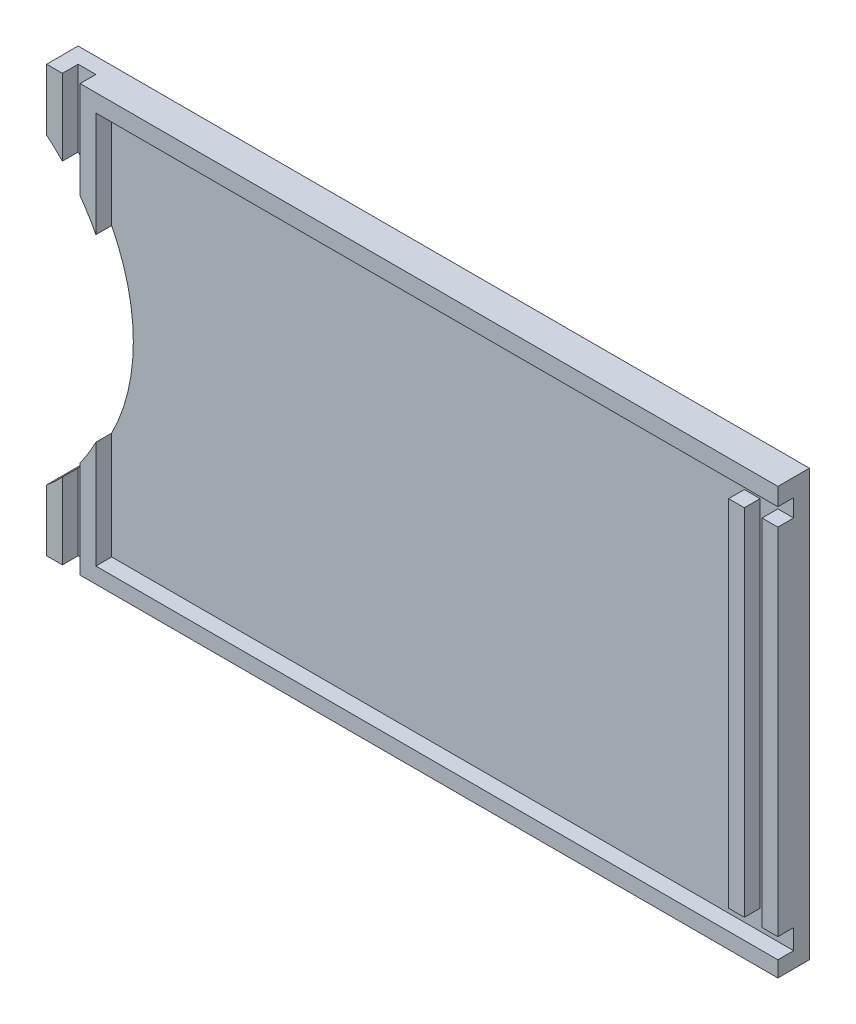
from build123d import *

# Parameters (mm, degrees)
BOSS_EXTRUDE1_DEPTH = 54
SKETCH7_W           = 12.542465984
SKETCH7_H           = 8.941456765
CUT_EXTRUDE4_DEPTH  = 4
SKETCH8_W           = 12.536281236
SKETCH8_H           = 9.084679825
CUT_EXTRUDE5_DEPTH  = 4
SKETCH10_R          = 50
CUT_EXTRUDE6_DEPTH  = 10
SKETCH12_W          = 173
SKETCH12_H          = 4
SKETCH12_H_2        = 4.470728383
BOSS_EXTRUDE2_DEPTH = 4


with BuildPart() as part:
    # Sketch1 → Boss-Extrude1 (new, symmetric)
    with BuildSketch(Plane(origin=(0, 0, 0), x_dir=(1, 0, 0), z_dir=(0, 1, 0))):
        Polygon((-63.408892702, 20.487993735), (122.091107298, 20.487993735), (122.091107298, 12.487993735), (118.091107298, 12.487993735), (118.091107298, 16.487993735), (113.591107298, 16.487993735), (113.591107298, 12.487993735), (109.591107298, 12.487993735), (109.591107298, 16.487993735), (-50.908892702, 16.487993735), (-50.908892702, 12.487993735), (-54.908892702, 12.487993735), (-54.908892702, 16.487993735), (-59.408892702, 16.487993735), (-59.408892702, 12.487993735), (-63.408892702, 12.487993735), align=None)
    extrude(amount=BOSS_EXTRUDE1_DEPTH, both=True)

    # Sketch7 → Cut-Extrude4 (cut)
    with BuildSketch(Plane.XY.offset(-12.487993735)):
        with Locations((115.819874306, 49.529271618)):
            Rectangle(SKETCH7_W, SKETCH7_H)
    extrude(amount=-CUT_EXTRUDE4_DEPTH, mode=Mode.SUBTRACT)

    # Sketch8 → Cut-Extrude5 (cut)
    with BuildSketch(Plane.XY.offset(-12.487993735)):
        with Locations((115.82296668, -49.457660088)):
            Rectangle(SKETCH8_W, SKETCH8_H)
    extrude(amount=-CUT_EXTRUDE5_DEPTH, mode=Mode.SUBTRACT)

    # Sketch10 → Cut-Extrude6 (cut)
    with BuildSketch(Plane.XY.offset(-12.487993735)):
        with Locations((-95.408892702, 0)):
            Circle(SKETCH10_R)
    extrude(amount=-CUT_EXTRUDE6_DEPTH, mode=Mode.SUBTRACT)

    # Sketch12 → Boss-Extrude2 (add)
    with BuildSketch(Plane.XY.offset(-16.487993735)):
        with Locations((35.591107298, -52)):
            Rectangle(SKETCH12_W, SKETCH12_H)
        with Locations((35.591107298, 51.764635809)):
            Rectangle(SKETCH12_W, SKETCH12_H_2)
    extrude(amount=BOSS_EXTRUDE2_DEPTH)


solid = part.part
